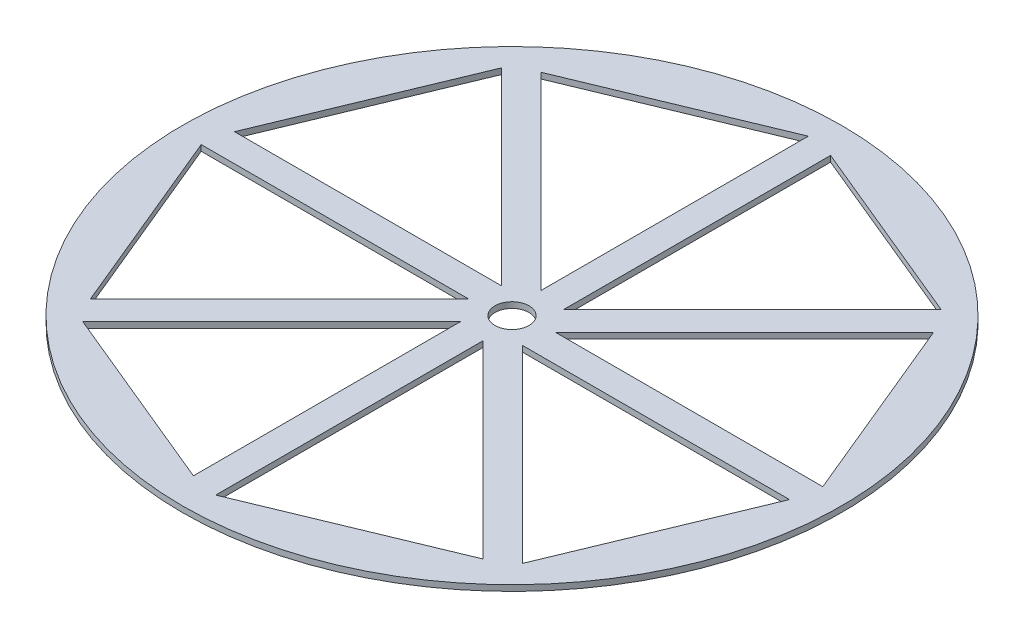
from build123d import *

# Parameters (mm, degrees)
SKETCH1_R           = 160.3375
SKETCH1_R_2         = 8.3
BOSS_EXTRUDE1_DEPTH = 2.85
CUT_EXTRUDE1_DEPTH  = 227.769376928


with BuildPart() as part:
    # Sketch1 → Boss-Extrude1 (new body)
    with BuildSketch(Plane(origin=(0, 0, 0), x_dir=(1, 0, 0), z_dir=(0, 1, 0))):
        with Locations(Location((0, 0, 0), (0, 0, 270))):
            Circle(SKETCH1_R)
        with Locations(Location((0, 0, 0), (0, 0, 270))):
            Circle(SKETCH1_R_2, mode=Mode.SUBTRACT)
    extrude(amount=BOSS_EXTRUDE1_DEPTH)

    # Sketch3 → Cut-Extrude1 (cut, through all)
    with BuildSketch(Plane(origin=(0, 2.85, 0), x_dir=(1, 0, 0), z_dir=(0, 1, 0))):
        Polygon((-15, 10), (-106.923881554, 101.923881554), (-145, 10), align=None)
        Polygon((-95.45941546, 109.601551084), (-3.535533906, 17.67766953), (-3.535533906, 147.67766953), align=None)
        Polygon((10, 145), (10, 15), (101.923881554, 106.923881554), align=None)
        Polygon((109.601551084, 95.45941546), (17.67766953, 3.535533906), (147.67766953, 3.535533906), align=None)
        Polygon((145, -10), (15, -10), (106.923881554, -101.923881554), align=None)
        Polygon((95.45941546, -109.601551084), (3.535533906, -17.67766953), (3.535533906, -147.67766953), align=None)
        Polygon((-10, -145), (-10, -15), (-101.923881554, -106.923881554), align=None)
        Polygon((-109.601551084, -95.45941546), (-17.67766953, -3.535533906), (-147.67766953, -3.535533906), align=None)
    extrude(amount=-CUT_EXTRUDE1_DEPTH, mode=Mode.SUBTRACT)


solid = part.part
